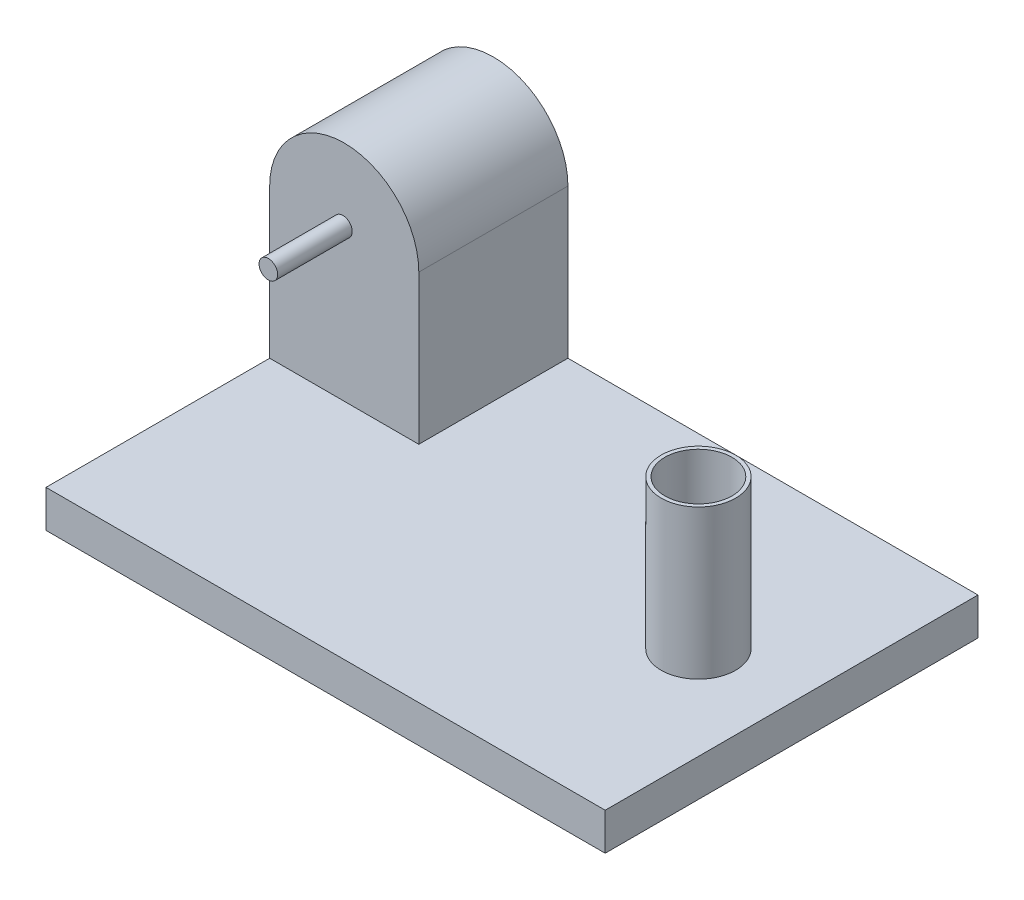
from build123d import *

# Parameters (mm, degrees)
SKETCH1_W           = 150
SKETCH1_H           = 100
BOSS_EXTRUDE1_DEPTH = 10
SKETCH2_R           = 10
BOSS_EXTRUDE2_DEPTH = 40
SKETCH3_R           = 9
CUT_EXTRUDE2_DEPTH  = 40
SKETCH4_W           = 40
SKETCH4_H           = 40
BOSS_EXTRUDE3_DEPTH = 60
CUT_EXTRUDE3_DEPTH  = 50
CUT_EXTRUDE4_DEPTH  = 50
SKETCH8_R           = 2.5
BOSS_EXTRUDE5_DEPTH = 20


with BuildPart() as part:
    # Sketch1 → Boss-Extrude1 (new body)
    with BuildSketch(Plane(origin=(0, 0, 0), x_dir=(1, 0, 0), z_dir=(0, 1, 0))):
        Rectangle(SKETCH1_W, SKETCH1_H)
    extrude(amount=BOSS_EXTRUDE1_DEPTH)

    # Sketch2 → Boss-Extrude2 (add)
    with BuildSketch(Plane(origin=(0, 10, 0), x_dir=(1, 0, 0), z_dir=(0, 1, 0))):
        with Locations(Location((50, 0, 0), (0, 0, 90))):
            Circle(SKETCH2_R)
    extrude(amount=BOSS_EXTRUDE2_DEPTH)

    # Sketch3 → Cut-Extrude2 (cut)
    with BuildSketch(Plane(origin=(0, 50, 0), x_dir=(1, 0, 0), z_dir=(0, 1, 0))):
        with Locations(Location((50, 0, 0), (0, 0, 270))):
            Circle(SKETCH3_R)
    extrude(amount=-CUT_EXTRUDE2_DEPTH, mode=Mode.SUBTRACT)

    # Sketch4 → Boss-Extrude3 (add)
    with BuildSketch(Plane(origin=(0, 10, 0), x_dir=(1, 0, 0), z_dir=(0, 1, 0))):
        with Locations((-55, 30)):
            Rectangle(SKETCH4_W, SKETCH4_H)
    extrude(amount=BOSS_EXTRUDE3_DEPTH)

    # Sketch6 → Cut-Extrude3 (cut)
    with BuildSketch(Plane.XY.offset(-10)):
        with BuildLine():
            Line((-75, 50), (-75, 70))
            Line((-75, 70), (-55, 70))
            ThreePointArc((-55, 70), (-69.142135624, 64.142135624), (-75, 50))
        make_face()
    extrude(amount=-CUT_EXTRUDE3_DEPTH, mode=Mode.SUBTRACT)

    # Sketch7 → Cut-Extrude4 (cut)
    with BuildSketch(Plane.XY.offset(-10)):
        with BuildLine():
            Line((-55, 70), (-35, 70))
            Line((-35, 70), (-35, 50))
            ThreePointArc((-35, 50), (-40.857864376, 64.142135624), (-55, 70))
        make_face()
    extrude(amount=-CUT_EXTRUDE4_DEPTH, mode=Mode.SUBTRACT)

    # Sketch8 → Boss-Extrude5 (add)
    with BuildSketch(Plane.XY.offset(-10)):
        with Locations(Location((-55.353289102, 50.491778343, 0), (0, 0, 180))):
            Circle(SKETCH8_R)
    extrude(amount=BOSS_EXTRUDE5_DEPTH)


solid = part.part
